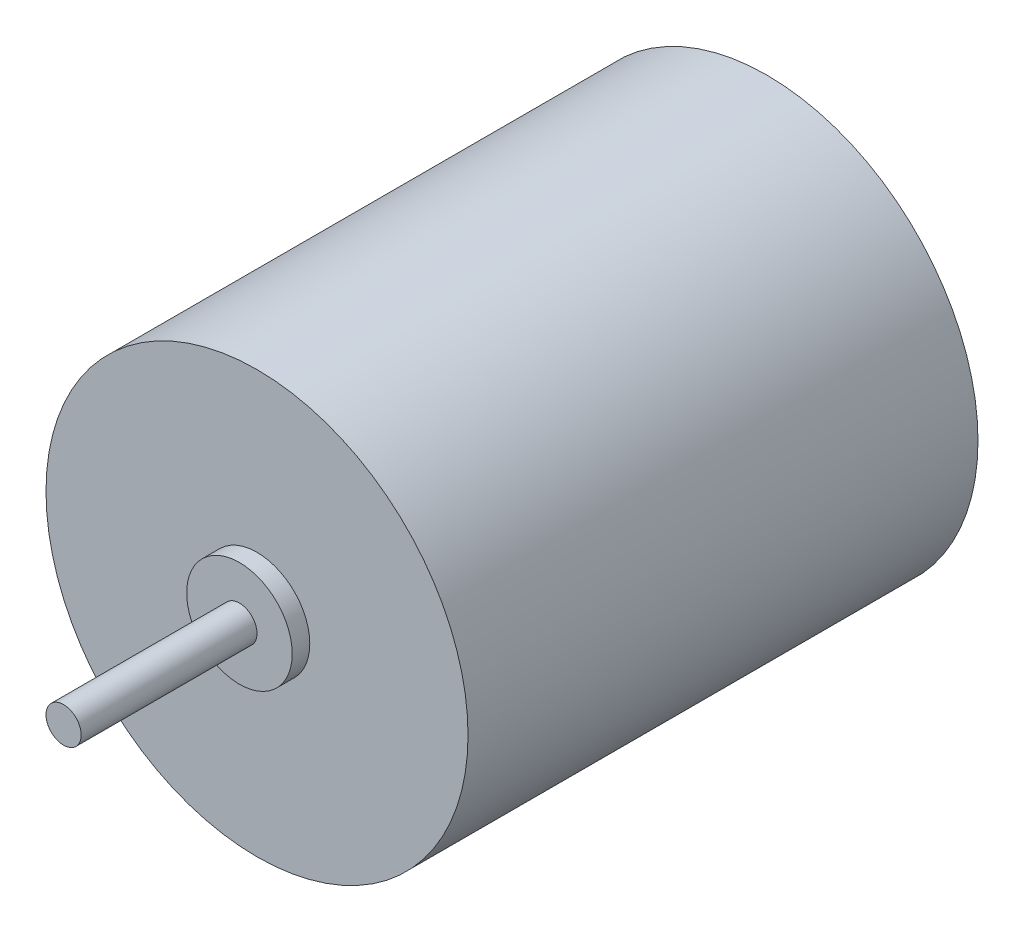
from build123d import *

# Parameters (mm, degrees)
SKETCH1_R           = 12
BOSS_EXTRUDE1_DEPTH = 29
SKETCH2_R           = 3
BOSS_EXTRUDE2_DEPTH = 1
SKETCH3_R           = 1
BOSS_EXTRUDE3_DEPTH = 10


with BuildPart() as part:
    # Sketch1 → Boss-Extrude1 (new body)
    with BuildSketch(Plane.XY):
        with Locations(Location((0, 0, 0), (0, 0, 180))):
            Circle(SKETCH1_R)
    extrude(amount=BOSS_EXTRUDE1_DEPTH)

    # Sketch2 → Boss-Extrude2 (add)
    with BuildSketch(Plane.XY.offset(29)):
        Circle(SKETCH2_R)
    extrude(amount=BOSS_EXTRUDE2_DEPTH)

    # Sketch3 → Boss-Extrude3 (add)
    with BuildSketch(Plane.XY.offset(30)):
        Circle(SKETCH3_R)
    extrude(amount=BOSS_EXTRUDE3_DEPTH)


solid = part.part
